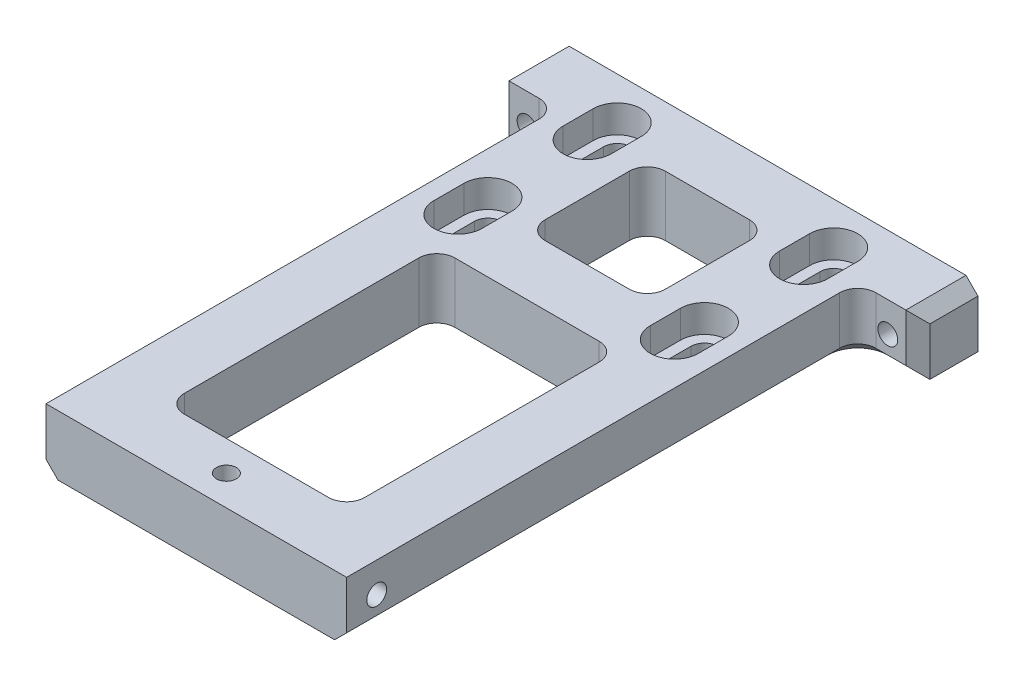
from build123d import *

# Parameters (mm, degrees)
SKETCH1_W                                            = 70
SKETCH1_H                                            = 40.5
BOSS_EXTRUDE1_DEPTH                                  = 5
CBORE_FOR_M4_HEXAGON_SOCKET_HEAD_CAP_SCR_D           = 4.5
CBORE_FOR_M4_HEXAGON_SOCKET_HEAD_CAP_SCR_CBORE_D     = 8
CBORE_FOR_M4_HEXAGON_SOCKET_HEAD_CAP_SCR_CBORE_DEPTH = 4.6
CUT_EXTRUDE1_DEPTH                                   = 41.794883258
CUT_EXTRUDE2_DEPTH                                   = 41.794883258
M4_TAPPED_HOLE1_D                                    = 3.3
SKETCH10_W                                           = 10
SKETCH10_H                                           = 30.5
CUT_EXTRUDE3_DEPTH                                   = 42.654081433
SKETCH13_W                                           = 50
SKETCH13_H                                           = 54.5
BOSS_EXTRUDE3_DEPTH                                  = 10
SKETCH14_W                                           = 20
SKETCH14_H                                           = 20
SKETCH14_W_2                                         = 30
SKETCH14_H_2                                         = 45
CUT_EXTRUDE4_DEPTH                                   = 84.141821606
M4_TAPPED_HOLE3_D                                    = 3.3
M4_TAPPED_HOLE3_DEPTH                                = 11.5
M4_TAPPED_HOLE3_TIP                                  = 0.991420021
FILLET1_R                                            = 3
CHAMFER1_SIZE                                        = 2
CHAMFER2_SIZE                                        = 2
CHAMFER3_SIZE                                        = 2


with BuildPart() as part:
    # Sketch1 → Boss-Extrude1 (new, symmetric)
    with BuildSketch(Plane(origin=(0, 0, 0), x_dir=(1, 0, 0), z_dir=(0, 1, 0))):
        Rectangle(SKETCH1_W, SKETCH1_H)
    extrude(amount=BOSS_EXTRUDE1_DEPTH, both=True)

    # CBORE for M4 Hexagon socket head cap screws1 (through all)
    with Locations(Plane(origin=(0, 5, 0), x_dir=(1, 0, 0), z_dir=(0, 1, 0))):
        with Locations((-18, 10.75), (18, 10.75), (18, -10.75), (-18, -10.75)):
            CounterBoreHole(CBORE_FOR_M4_HEXAGON_SOCKET_HEAD_CAP_SCR_D / 2, CBORE_FOR_M4_HEXAGON_SOCKET_HEAD_CAP_SCR_CBORE_D / 2, CBORE_FOR_M4_HEXAGON_SOCKET_HEAD_CAP_SCR_CBORE_DEPTH)

    # Sketch4 → Cut-Extrude1 (cut, through all)
    with BuildSketch(Plane(origin=(0, 0.4, 0), x_dir=(1, 0, 0), z_dir=(0, 1, 0))):
        with BuildLine():
            Line((-22, 8.25), (-22, 13.25))
            ThreePointArc((-22, 13.25), (-18, 17.25), (-14, 13.25))
            Line((-14, 13.25), (-14, 8.25))
            ThreePointArc((-14, 8.25), (-18, 4.25), (-22, 8.25))
        make_face()
        with BuildLine():
            Line((22, 13.25), (22, 8.25))
            ThreePointArc((22, 8.25), (18, 4.25), (14, 8.25))
            Line((14, 8.25), (14, 13.25))
            ThreePointArc((14, 13.25), (18, 17.25), (22, 13.25))
        make_face()
        with BuildLine():
            Line((-14, -8.25), (-14, -13.25))
            ThreePointArc((-14, -13.25), (-18, -17.25), (-22, -13.25))
            Line((-22, -13.25), (-22, -8.25))
            ThreePointArc((-22, -8.25), (-18, -4.25), (-14, -8.25))
        make_face()
        with BuildLine():
            Line((22, -8.25), (22, -13.25))
            ThreePointArc((22, -13.25), (18, -17.25), (14, -13.25))
            Line((14, -13.25), (14, -8.25))
            ThreePointArc((14, -8.25), (18, -4.25), (22, -8.25))
        make_face()
    extrude(amount=CUT_EXTRUDE1_DEPTH, mode=Mode.SUBTRACT)

    # Sketch5 → Cut-Extrude2 (cut, through all)
    with BuildSketch(Plane(origin=(0, 0.4, 0), x_dir=(1, 0, 0), z_dir=(0, 1, 0))):
        with BuildLine():
            Line((-15.75, 13.25), (-15.75, 8.25))
            ThreePointArc((-15.75, 8.25), (-18, 6), (-20.25, 8.25))
            Line((-20.25, 8.25), (-20.25, 13.25))
            ThreePointArc((-20.25, 13.25), (-18, 15.5), (-15.75, 13.25))
        make_face()
        with BuildLine():
            Line((20.25, 13.25), (20.25, 8.25))
            ThreePointArc((20.25, 8.25), (18, 6), (15.75, 8.25))
            Line((15.75, 8.25), (15.75, 13.25))
            ThreePointArc((15.75, 13.25), (18, 15.5), (20.25, 13.25))
        make_face()
        with BuildLine():
            Line((-15.75, -8.25), (-15.75, -13.25))
            ThreePointArc((-15.75, -13.25), (-18, -15.5), (-20.25, -13.25))
            Line((-20.25, -13.25), (-20.25, -8.25))
            ThreePointArc((-20.25, -8.25), (-18, -6), (-15.75, -8.25))
        make_face()
        with BuildLine():
            Line((20.25, -8.25), (20.25, -13.25))
            ThreePointArc((20.25, -13.25), (18, -15.5), (15.75, -13.25))
            Line((15.75, -13.25), (15.75, -8.25))
            ThreePointArc((15.75, -8.25), (18, -6), (20.25, -8.25))
        make_face()
    extrude(amount=-CUT_EXTRUDE2_DEPTH, mode=Mode.SUBTRACT)

    # M4 Tapped Hole1 (through all)
    with Locations(Plane(origin=(0, 0, -20.25), x_dir=(-1, 0, 0), z_dir=(0, 0, -1))):
        with Locations((-30, 0), (30, 0)):
            Hole(M4_TAPPED_HOLE1_D / 2)

    # Sketch10 → Cut-Extrude3 (cut, through all)
    with BuildSketch(Plane(origin=(0, 5, 0), x_dir=(1, 0, 0), z_dir=(0, 1, 0))):
        with Locations((-30, -5)):
            Rectangle(SKETCH10_W, SKETCH10_H)
        with Locations((30, -5)):
            Rectangle(SKETCH10_W, SKETCH10_H)
    extrude(amount=-CUT_EXTRUDE3_DEPTH, mode=Mode.SUBTRACT)

    # Sketch13 → Boss-Extrude3 (add)
    with BuildSketch(Plane(origin=(0, 5, 0), x_dir=(1, 0, 0), z_dir=(0, 1, 0))):
        with Locations((0, -47.5)):
            Rectangle(SKETCH13_W, SKETCH13_H)
    extrude(amount=-BOSS_EXTRUDE3_DEPTH)

    # Sketch14 → Cut-Extrude4 (cut, through all)
    with BuildSketch(Plane(origin=(0, 5, 0), x_dir=(1, 0, 0), z_dir=(0, 1, 0))):
        with Locations((0, 0.25)):
            Rectangle(SKETCH14_W, SKETCH14_H)
        with Locations((0, -42.25)):
            Rectangle(SKETCH14_W_2, SKETCH14_H_2)
    extrude(amount=-CUT_EXTRUDE4_DEPTH, mode=Mode.SUBTRACT)

    # Sketch17 → M4 Tapped Hole2 (revolve, cut)
    with BuildSketch(Plane(origin=(-25, 0, 69.75), x_dir=(0, 0, 1), z_dir=(0, 1, 0))):
        Polygon((0, 0), (0, 12.491420021), (1.65, 11.5), (1.65, 0), align=None)
    m4_tapped_hole2 = revolve(axis=Axis((-31.35, 0, 69.75), (1, 0, 0)), mode=Mode.SUBTRACT)

    # Mirror1: M4 Tapped Hole2 across plane
    add(m4_tapped_hole2.mirror(Plane(origin=(0, 0, 0), x_dir=(0, 0, 1), z_dir=(1, 0, 0))), mode=Mode.SUBTRACT)

    # M4 Tapped Hole3
    with Locations(Plane(origin=(0, 5, 0), x_dir=(1, 0, 0), z_dir=(0, 1, 0))):
        with Locations((0, -69.75)):
            Hole(M4_TAPPED_HOLE3_D / 2, depth=M4_TAPPED_HOLE3_DEPTH)
            with Locations((0, 0, -(M4_TAPPED_HOLE3_DEPTH + M4_TAPPED_HOLE3_TIP / 2))):  # 118° drill point
                Cone(0, M4_TAPPED_HOLE3_D / 2, M4_TAPPED_HOLE3_TIP, mode=Mode.SUBTRACT)

    # Fillet1
    fillet1_edges = [part.edges().sort_by_distance(p)[0] for p in [
        (-25, 0, -10.25),
        (25, 0, -10.25),
        (-10, 0, 9.75),
        (-10, 0, -10.25),
        (10, 0, -10.25),
        (10, 0, 9.75),
        (-15, 0, 19.75),
        (15, 0, 19.75),
        (15, 0, 64.75),
        (-15, 0, 64.75),
    ]]
    fillet(fillet1_edges, radius=FILLET1_R)

    # Chamfer1
    chamfer1_edges = [part.edges().sort_by_distance(p)[0] for p in [
        (-35, 0, -10.25),
        (35, 0, -10.25),
    ]]
    chamfer(chamfer1_edges, length=CHAMFER1_SIZE)

    # Chamfer2
    chamfer2_edges = [part.edges().sort_by_distance(p)[0] for p in [
        (35, 5, -16.25),
        (-35, 5, -16.25),
    ]]
    chamfer(chamfer2_edges, length=CHAMFER2_SIZE)

    # Chamfer3
    chamfer3_edges = [part.edges().sort_by_distance(p)[0] for p in [
        (-30.5, -5, -10.25),
        (-25.878679656, -5, -9.371320344),
        (-25, -5, 33.75),
        (30.5, -5, -10.25),
        (25.878679656, -5, -9.371320344),
        (25, -5, 33.75),
    ]]
    chamfer(chamfer3_edges, length=CHAMFER3_SIZE)


solid = part.part
